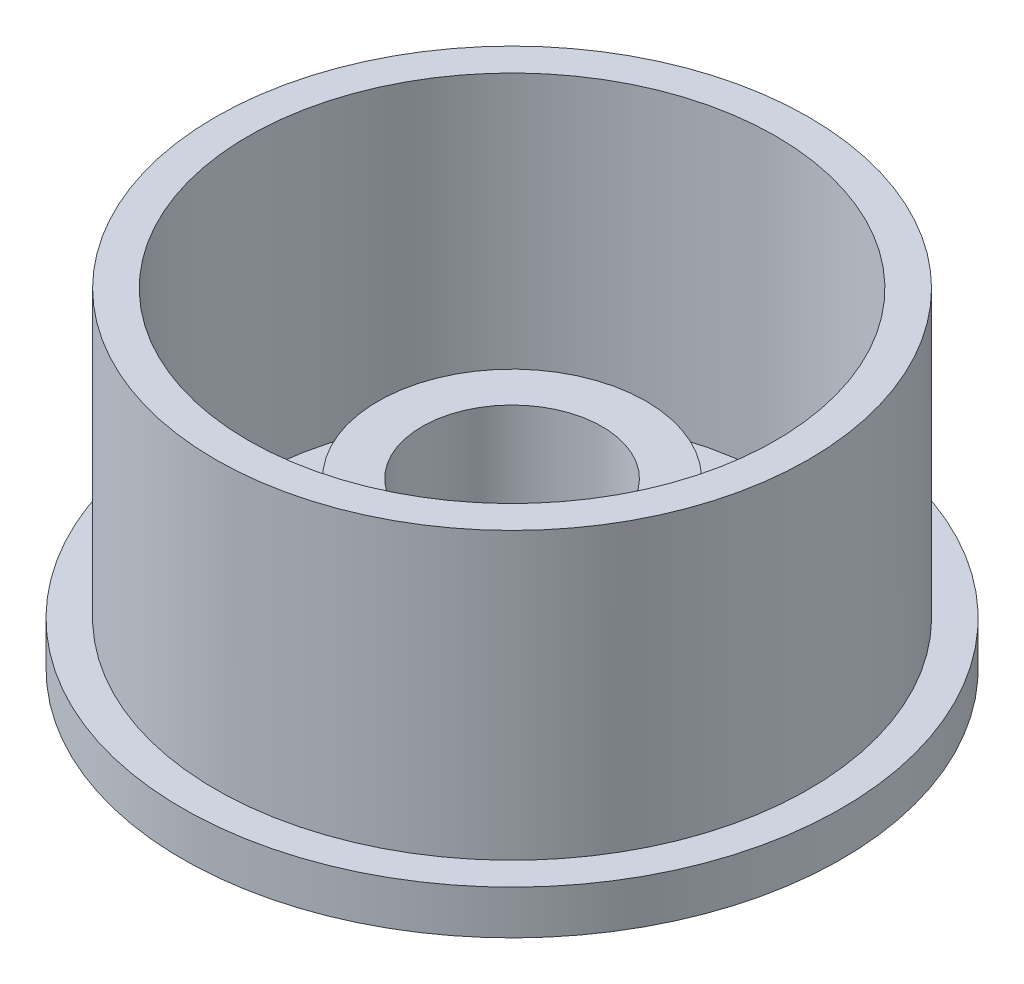
from build123d import *

# Parameters (mm, degrees)
SKETCH1_R           = 13.5
BOSS_EXTRUDE1_DEPTH = 15
SHELL1_T            = -1.5
SKETCH2_R           = 4.1
CUT_EXTRUDE1_DEPTH  = 20
BOSS_EXTRUDE2_START = 6
SKETCH3_R           = 6.1
SKETCH3_R_2         = 4.1
BOSS_EXTRUDE2_DEPTH = 6
SKETCH4_R           = 15
SKETCH4_R_2         = 12.5
BOSS_EXTRUDE3_DEPTH = 2


with BuildPart() as part:
    # Sketch1 → Boss-Extrude1 (new body)
    with BuildSketch(Plane(origin=(0, 0, 0), x_dir=(1, 0, 0), z_dir=(0, 1, 0))):
        with Locations(Location((0, 0, 0), (0, 0, 270))):
            Circle(SKETCH1_R)
    extrude(amount=BOSS_EXTRUDE1_DEPTH)

    # Shell1
    shell1_openings = [part.faces().sort_by_distance(p)[0] for p in [
        (0, 15, 0),
    ]]
    offset(amount=SHELL1_T, openings=shell1_openings, kind=Kind.INTERSECTION)

    # Sketch2 → Cut-Extrude1 (cut)
    with BuildSketch(Plane(origin=(0, 1.5, 0), x_dir=(1, 0, 0), z_dir=(0, 1, 0))):
        with Locations(Location((0, 0, 0), (0, 0, 270))):
            Circle(SKETCH2_R)
    extrude(amount=-CUT_EXTRUDE1_DEPTH, mode=Mode.SUBTRACT)

    # Sketch3 → Boss-Extrude2 (add)
    with BuildSketch(Plane(origin=(0, 1.5, 0), x_dir=(1, 0, 0), z_dir=(0, 1, 0)).offset(BOSS_EXTRUDE2_START)):
        with Locations(Location((0, 0, 0), (0, 0, 90))):
            Circle(SKETCH3_R)
        with Locations(Location((0, 0, 0), (0, 0, 270))):
            Circle(SKETCH3_R_2, mode=Mode.SUBTRACT)
    extrude(amount=-BOSS_EXTRUDE2_DEPTH)


with BuildPart() as body_2:
    # Sketch4 → Boss-Extrude3 (new body)
    with BuildSketch(Plane.XZ):
        with Locations(Location((0, 0, 0), (0, 0, 270))):
            Circle(SKETCH4_R)
        with Locations(Location((0, 0, 0), (0, 0, 270))):
            Circle(SKETCH4_R_2, mode=Mode.SUBTRACT)
    extrude(amount=-BOSS_EXTRUDE3_DEPTH)


with BuildPart() as part_1:
    add(part.part)

    # Combine1: union body 2
    add(body_2.part)


solid = part_1.part
